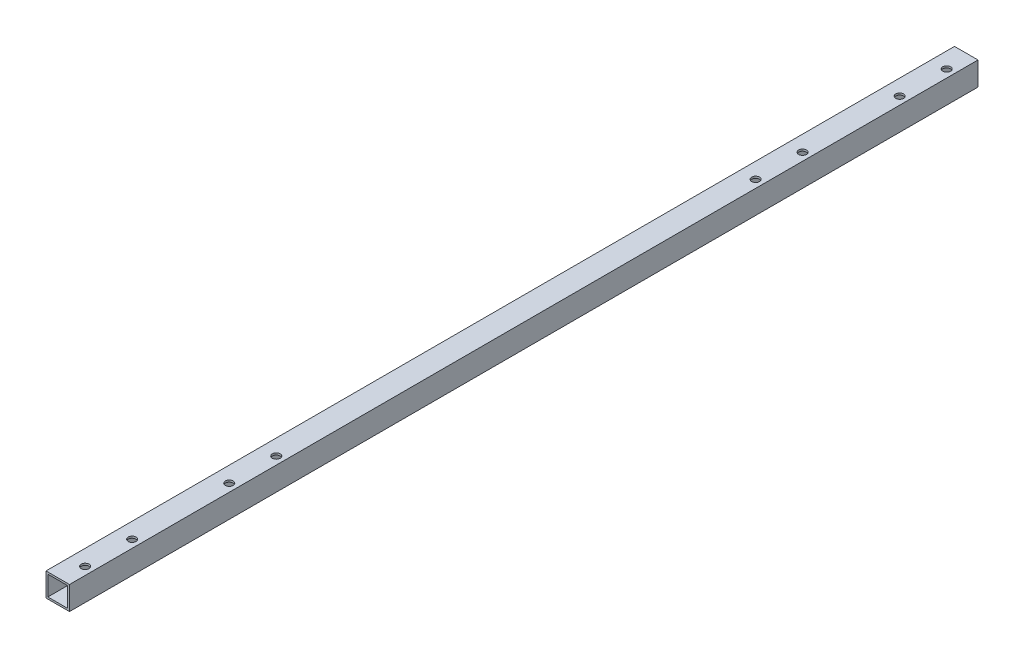
from build123d import *

# Parameters (mm, degrees)
SKETCH_1_W          = 15
SKETCH_1_H          = 15
SKETCH_1_W_2        = 12.6
SKETCH_1_H_2        = 12.6
EXTRUDE_1_DEPTH     = 570
SKETCH_2_R          = 2.5
CUT_EXTRUDE_1_DEPTH = 25
SKETCH_4_W          = 15
SKETCH_4_H          = 15
SKETCH_4_W_2        = 12.6
SKETCH_4_H_2        = 12.6
EXTRUDE_2_DEPTH     = 10


with BuildPart() as part:
    # 草图1 → 凸台-拉伸1 (new body)
    with BuildSketch(Plane.XY):
        Rectangle(SKETCH_1_W, SKETCH_1_H)
        Rectangle(SKETCH_1_W_2, SKETCH_1_H_2, mode=Mode.SUBTRACT)
    extrude(amount=EXTRUDE_1_DEPTH)

    # 草图2 → 切除-拉伸1 (cut)
    with BuildSketch(Plane.XZ.offset(7.5)):
        with Locations((2.5, 565)):
            Circle(SKETCH_2_R)
        with Locations((2.5, 535)):
            Circle(SKETCH_2_R)
        with Locations((2.5, 473)):
            Circle(SKETCH_2_R)
        with Locations((2.5, 443)):
            Circle(SKETCH_2_R)
    cut_extrude_1 = extrude(amount=-CUT_EXTRUDE_1_DEPTH, mode=Mode.SUBTRACT)

    # 草图4 → 凸台-拉伸2 (add)
    with BuildSketch(Plane.XY.offset(570)):
        Rectangle(SKETCH_4_W, SKETCH_4_H)
        Rectangle(SKETCH_4_W_2, SKETCH_4_H_2, mode=Mode.SUBTRACT)
    extrude(amount=EXTRUDE_2_DEPTH)

    # 镜向1: 切除-拉伸1 across plane
    add(cut_extrude_1.mirror(Plane.XY.offset(290)), mode=Mode.SUBTRACT)


solid = part.part
